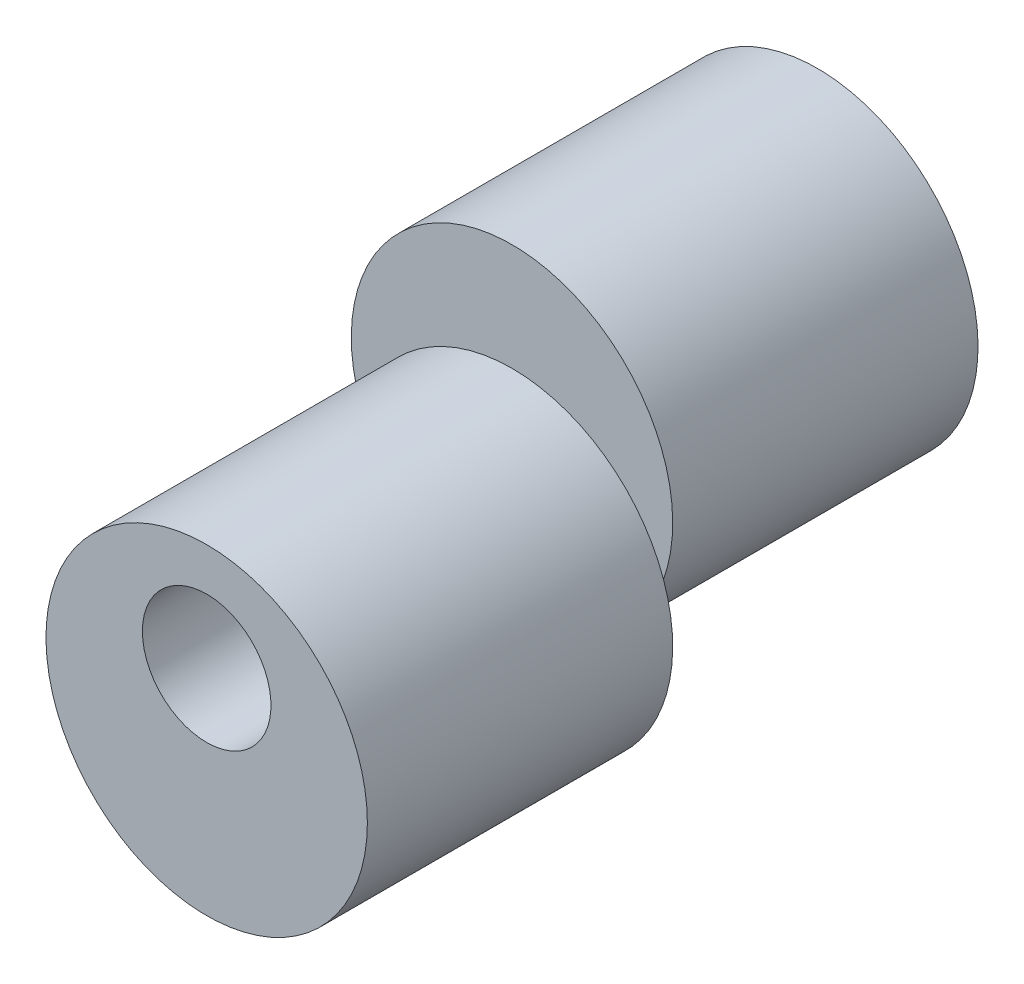
from build123d import *

# Parameters (mm, degrees)
SKETCH1_R           = 7.5
BOSS_EXTRUDE1_DEPTH = 14.25
SKETCH2_R           = 7.5
BOSS_EXTRUDE2_DEPTH = 14.25
SKETCH3_R           = 3
CUT_EXTRUDE1_DEPTH  = 32.120732639


with BuildPart() as part:
    # Sketch1 → Boss-Extrude1 (new body)
    with BuildSketch(Plane.XY):
        with Locations(Location((0, -2.5, 0), (0, 0, 180))):
            Circle(SKETCH1_R)
    extrude(amount=BOSS_EXTRUDE1_DEPTH)

    # Sketch2 → Boss-Extrude2 (add)
    with BuildSketch(Plane(origin=(0, 0, 0), x_dir=(-1, 0, 0), z_dir=(0, 0, -1))):
        with Locations(Location((0, 2.5, 0), (0, 0, 199.471220634))):
            Circle(SKETCH2_R)
    extrude(amount=BOSS_EXTRUDE2_DEPTH)

    # Sketch3 → Cut-Extrude1 (cut, through all)
    with BuildSketch(Plane(origin=(0, 0, -14.25), x_dir=(-1, 0, 0), z_dir=(0, 0, -1))):
        Circle(SKETCH3_R)
    extrude(amount=-CUT_EXTRUDE1_DEPTH, mode=Mode.SUBTRACT)


solid = part.part
